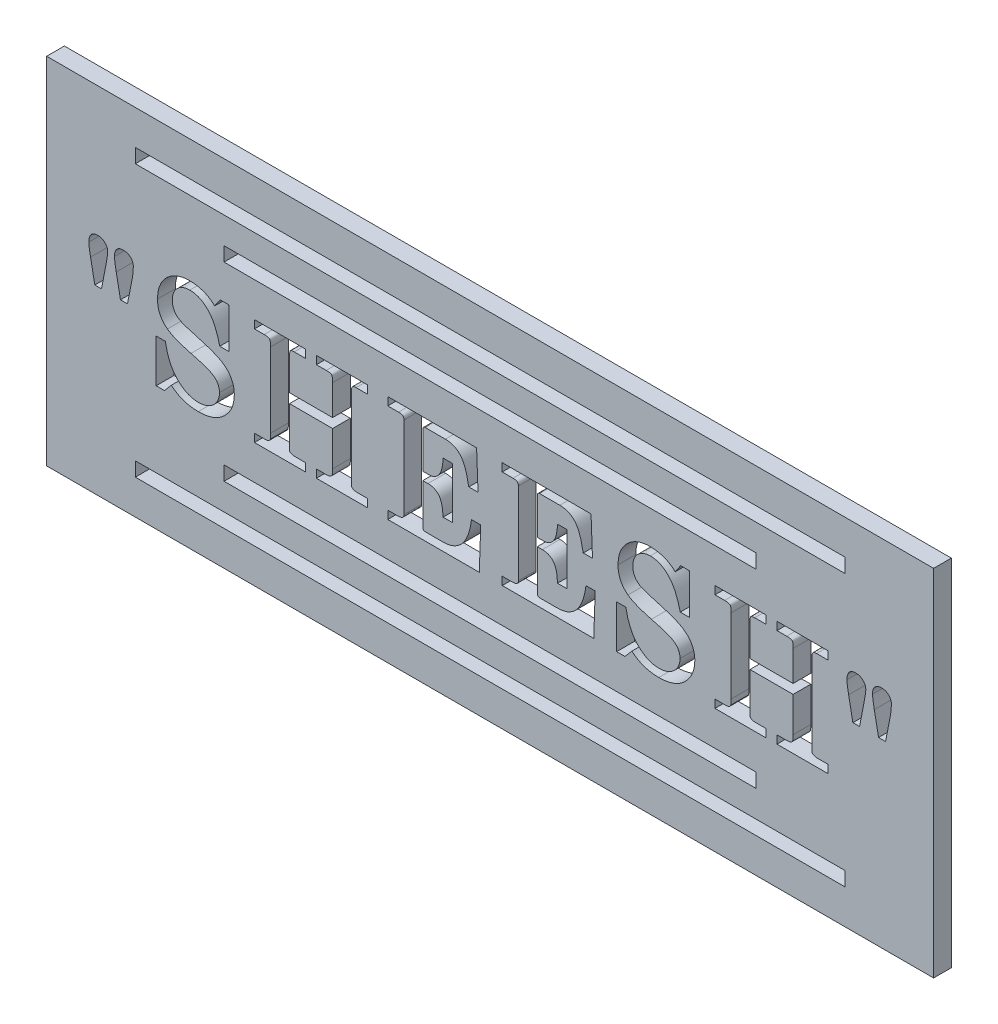
from build123d import *

# Parameters (mm, degrees)
SKETCH1_W           = 500
SKETCH1_H           = 200
SKETCH1_W_2         = 400
SKETCH1_H_2         = 8
SKETCH1_W_3         = 300
BOSS_EXTRUDE1_DEPTH = 10


with BuildPart() as part:
    # Sketch1 → Boss-Extrude1 (new body)
    with BuildSketch(Plane.XY):
        Rectangle(SKETCH1_W, SKETCH1_H)
        with Locations((0, 76.5)):
            Rectangle(SKETCH1_W_2, SKETCH1_H_2, mode=Mode.SUBTRACT)
        with Locations((0, 53.5)):
            Rectangle(SKETCH1_W_3, SKETCH1_H_2, mode=Mode.SUBTRACT)
        with Locations((0, -76.5)):
            Rectangle(SKETCH1_W_2, SKETCH1_H_2, mode=Mode.SUBTRACT)
        with Locations((0, -53.5)):
            Rectangle(SKETCH1_W_3, SKETCH1_H_2, mode=Mode.SUBTRACT)
        with BuildLine():
            Line((-222.856012658, 1.898734177), (-225.241297468, 14.299841772))
            add(Edge.make_bspline(
                [(-225.241297468, 14.299841772), (-225.318102546, 14.687192515), (-225.465996871, 15.433067381), (-225.65297757, 16.514319414), (-225.818124979, 17.507379698), (-225.964987305, 18.412015943), (-226.07429705, 19.231044839), (-226.140658225, 19.963851805), (-226.197168862, 20.608318296), (-226.200830159, 21.008600319), (-226.202531646, 21.194620253)],
                knots=[0, 0, 0, 0, 1.359655747, 2.618125993, 3.778022415, 4.825997999, 5.773767445, 6.622178217, 7.359695656, 8, 8, 8, 8], degree=3))
            add(Edge.make_bspline(
                [(-226.202531646, 21.194620253), (-226.189564923, 21.647118965), (-226.165219749, 22.496690602), (-225.909089843, 23.681974668), (-225.518731247, 24.700805307), (-224.934335383, 25.531881954), (-224.205336462, 26.165446657), (-223.373167847, 26.649835697), (-222.403772082, 26.906425424), (-221.726034938, 26.942969357), (-221.372626582, 26.962025316)],
                knots=[0, 0, 0, 0, 1.270862651, 2.38605953, 3.394385714, 4.320533972, 5.211316542, 6.093229129, 7.005707794, 8, 8, 8, 8], degree=3))
            add(Edge.make_bspline(
                [(-221.372626582, 26.962025316), (-220.955312842, 26.946264862), (-220.148702914, 26.915802075), (-219.007278145, 26.612469741), (-217.99462394, 26.120294146), (-217.142929701, 25.434904285), (-216.446141524, 24.63861562), (-215.931591286, 23.75441976), (-215.620035246, 22.797417755), (-215.586526684, 22.13437419), (-215.569620253, 21.799841772)],
                knots=[0, 0, 0, 0, 1.154916135, 2.232293665, 3.247594324, 4.254746992, 5.242118899, 6.165794001, 7.074568551, 8, 8, 8, 8], degree=3))
            add(Edge.make_bspline(
                [(-215.569620253, 21.799841772), (-215.57109047, 21.64541975), (-215.574491862, 21.288159751), (-215.647743939, 20.687999904), (-215.724898144, 19.951286845), (-215.844728595, 19.080135388), (-216.017881861, 18.077743391), (-216.202665681, 16.936960485), (-216.431474996, 15.663739365), (-216.5976004, 14.770474545), (-216.685126582, 14.299841772)],
                knots=[0, 0, 0, 0, 0.488047033, 1.129111508, 1.909654003, 2.831406391, 3.909075828, 5.12659328, 6.486093553, 8, 8, 8, 8], degree=3))
            Line((-216.685126582, 14.299841772), (-219.070411392, 1.898734177))
            Line((-219.070411392, 1.898734177), (-222.856012658, 1.898734177))
        make_face(mode=Mode.SUBTRACT)
        with BuildLine():
            Line((-208.378164557, 1.898734177), (-210.775316456, 14.299841772))
            add(Edge.make_bspline(
                [(-210.775316456, 14.299841772), (-210.855568655, 14.711014187), (-211.009698664, 15.500699804), (-211.213237115, 16.639837744), (-211.374227751, 17.681697875), (-211.52279548, 18.617807726), (-211.626512842, 19.45357005), (-211.713921043, 20.188530921), (-211.765415916, 20.825977412), (-211.77004887, 21.218282393), (-211.772151899, 21.396360759)],
                knots=[0, 0, 0, 0, 1.401467564, 2.69161728, 3.870781524, 4.928194173, 5.862141366, 6.687810886, 7.404360115, 8, 8, 8, 8], degree=3))
            add(Edge.make_bspline(
                [(-211.772151899, 21.396360759), (-211.760019956, 21.833245774), (-211.737154855, 22.656643968), (-211.469199194, 23.799539269), (-211.060004348, 24.784679229), (-210.449703787, 25.5808272), (-209.703993287, 26.210209562), (-208.833428866, 26.650382818), (-207.856522209, 26.923781074), (-207.169630541, 26.948923987), (-206.811708861, 26.962025316)],
                knots=[0, 0, 0, 0, 1.236768738, 2.330940888, 3.310742517, 4.239823643, 5.147795877, 6.056114706, 6.987091089, 8, 8, 8, 8], degree=3))
            add(Edge.make_bspline(
                [(-206.811708861, 26.962025316), (-206.390800833, 26.945295373), (-205.585753324, 26.913296934), (-204.446701675, 26.630224308), (-203.45694415, 26.129824266), (-202.628680026, 25.4493527), (-201.964511981, 24.648930759), (-201.492015513, 23.759070493), (-201.190038938, 22.80416443), (-201.156361185, 22.138330271), (-201.139240506, 21.799841772)],
                knots=[0, 0, 0, 0, 1.175948973, 2.249172575, 3.253477426, 4.252100082, 5.226596206, 6.142172504, 7.055540736, 8, 8, 8, 8], degree=3))
            add(Edge.make_bspline(
                [(-201.139240506, 21.799841772), (-201.153332472, 21.229951441), (-201.182442051, 20.052736841), (-201.340705602, 18.229809568), (-201.615540322, 16.297658911), (-201.872927057, 14.979159615), (-202.005537975, 14.299841772)],
                knots=[0, 0, 0, 0, 0.904493599, 1.868399958, 2.901755999, 4, 4, 4, 4], degree=3))
            Line((-202.005537975, 14.299841772), (-204.438291139, 1.898734177))
            Line((-204.438291139, 1.898734177), (-208.378164557, 1.898734177))
        make_face(mode=Mode.SUBTRACT)
        with BuildLine():
            Line((-155.309109403, 25.443037975), (-152.176198011, 30))
            Line((-152.176198011, 30), (-147.251356239, 30))
            Line((-147.251356239, 30), (-147.251356239, 7.215189873))
            Line((-147.251356239, 7.215189873), (-152.413539783, 7.215189873))
            add(Edge.make_bspline(
                [(-152.413539783, 7.215189873), (-152.620166884, 8.039829818), (-153.020845717, 9.638921947), (-153.718284657, 11.934745317), (-154.491335211, 14.042631575), (-155.300790942, 15.976929397), (-156.192740126, 17.712590259), (-157.14067561, 19.270152376), (-158.163567564, 20.635945387), (-159.233681792, 21.83448234), (-160.363255148, 22.861159709), (-161.523094016, 23.756242112), (-162.73030036, 24.505783206), (-163.969025282, 25.134024227), (-165.257794183, 25.604919824), (-166.579580419, 25.954307601), (-167.941182376, 26.159048472), (-168.860658242, 26.187958757), (-169.324141049, 26.202531646)],
                knots=[0, 0, 0, 0, 1.478441552, 2.866904838, 4.170608397, 5.382023723, 6.511257998, 7.561417234, 8.549360617, 9.47494599, 10.351468781, 11.200478944, 12.01943787, 12.819392841, 13.611738079, 14.401030875, 15.194003099, 16, 16, 16, 16], degree=3))
            add(Edge.make_bspline(
                [(-169.324141049, 26.202531646), (-169.664627315, 26.191684013), (-170.331815287, 26.170427915), (-171.31439117, 26.0541286), (-172.257848982, 25.841074408), (-173.155587876, 25.527018824), (-174.021231325, 25.152519814), (-174.830747302, 24.668308728), (-175.60471889, 24.108119011), (-176.337545951, 23.474368348), (-176.994791118, 22.767750796), (-177.573790632, 22.010464343), (-178.067165635, 21.201905605), (-178.446569041, 20.329583876), (-178.784913343, 19.424588375), (-178.985434014, 18.456246587), (-179.122307532, 17.444592038), (-179.1407108, 16.752868193), (-179.150090416, 16.400316456)],
                knots=[0, 0, 0, 0, 1.052011806, 2.061432996, 3.051512964, 4.033035075, 4.995818849, 5.959842525, 6.939994539, 7.944671068, 8.947562561, 9.915373557, 10.885649924, 11.864582464, 12.85012769, 13.86405047, 14.911367994, 16, 16, 16, 16], degree=3))
            add(Edge.make_bspline(
                [(-179.150090416, 16.400316456), (-179.136817863, 15.956403209), (-179.111308622, 15.103222172), (-178.904693793, 13.871087038), (-178.569658748, 12.740292663), (-178.071633464, 11.716715742), (-177.453269808, 10.79660665), (-176.701641094, 9.97748841), (-175.829079348, 9.249617457), (-174.988320947, 8.720013005), (-174.205670626, 8.332980981), (-173.488907651, 8.023697299), (-172.642443895, 7.70808152), (-171.677649401, 7.366228697), (-170.590291379, 7.007808963), (-169.379233575, 6.64089068), (-168.039577382, 6.266029536), (-167.105081932, 6.008379648), (-166.618444846, 5.874208861)],
                knots=[0, 0, 0, 0, 1.180352333, 2.268583414, 3.313885695, 4.307030757, 5.284835665, 6.253251243, 7.254393129, 8.299642433, 8.887939053, 9.576100266, 10.375491256, 11.290817276, 12.299178963, 13.421083908, 14.657033363, 16, 16, 16, 16], degree=3))
            add(Edge.make_bspline(
                [(-166.618444846, 5.874208861), (-165.850503688, 5.662528509), (-164.363339247, 5.25259672), (-162.221526066, 4.628454038), (-160.244752829, 4.006972584), (-158.425139641, 3.40785277), (-156.774178504, 2.801931268), (-155.277747766, 2.223631789), (-153.95179616, 1.644492364), (-152.424926751, 0.899236106), (-150.733803083, -0.072901938), (-148.969798538, -1.411501839), (-147.477528494, -2.888374412), (-146.275552276, -4.520190358), (-145.361091217, -6.283622484), (-144.682004093, -8.155446407), (-144.285470522, -10.15740574), (-144.237736797, -11.533064273), (-144.213381555, -12.234968354)],
                knots=[0, 0, 0, 0, 1.217609519, 2.357974383, 3.409782111, 4.384933562, 5.285857577, 6.09766231, 6.83684171, 7.496655379, 8.694421234, 9.811840936, 10.872164904, 11.892854872, 12.896241002, 13.898424008, 14.927710088, 16, 16, 16, 16], degree=3))
            add(Edge.make_bspline(
                [(-144.213381555, -12.234968354), (-144.227763938, -12.872783702), (-144.256029937, -14.126295535), (-144.526385766, -15.967315784), (-144.963010389, -17.734183895), (-145.587452723, -19.425466736), (-146.368946419, -21.049102802), (-147.341549262, -22.589184545), (-148.484732807, -24.049972087), (-149.787093776, -25.421885274), (-151.226954578, -26.67868838), (-152.797228595, -27.775990521), (-154.486662664, -28.688278946), (-156.272953158, -29.46060768), (-158.18377513, -30.030668944), (-160.197773627, -30.465375909), (-162.328231208, -30.713035105), (-163.785546965, -30.743787564), (-164.529837251, -30.759493671)],
                knots=[0, 0, 0, 0, 0.993765015, 1.953067152, 2.893816473, 3.826344344, 4.758545928, 5.69785916, 6.660030947, 7.645843102, 8.642473926, 9.6346688, 10.625367815, 11.631038732, 12.662931336, 13.728473925, 14.839870643, 16, 16, 16, 16], degree=3))
            add(Edge.make_bspline(
                [(-164.529837251, -30.759493671), (-165.282150143, -30.74433341), (-166.755458417, -30.714643983), (-168.914780528, -30.4583811), (-170.972494989, -30.047811535), (-172.928074543, -29.465997498), (-174.779702895, -28.71388687), (-176.529151903, -27.797838193), (-178.183092944, -26.716301281), (-179.18985972, -25.868992712), (-179.695976492, -25.443037975)],
                knots=[0, 0, 0, 0, 1.097676947, 2.149659464, 3.168680871, 4.15686523, 5.122824642, 6.080884398, 7.035231777, 8, 8, 8, 8], degree=3))
            Line((-179.695976492, -25.443037975), (-183.588381555, -30))
            Line((-183.588381555, -30), (-188.264014467, -30))
            Line((-188.264014467, -30), (-188.264014467, -5.696202532))
            Line((-188.264014467, -5.696202532), (-183.078096745, -5.696202532))
            add(Edge.make_bspline(
                [(-183.078096745, -5.696202532), (-182.925261273, -6.520933367), (-182.627299882, -8.128792742), (-182.036104575, -10.446030174), (-181.321981214, -12.601505921), (-180.505386306, -14.602270347), (-179.579268795, -16.448771793), (-178.546551253, -18.1452632), (-177.396096699, -19.681622986), (-176.132185875, -21.045156603), (-174.808723399, -22.249608223), (-173.448426377, -23.302813468), (-172.059112741, -24.201537659), (-170.62809038, -24.924601553), (-169.176668045, -25.502721112), (-167.692567962, -25.90898861), (-166.179483251, -26.151726587), (-165.159656966, -26.185569289), (-164.648508137, -26.202531646)],
                knots=[0, 0, 0, 0, 1.340731878, 2.613832573, 3.819754391, 4.96832973, 6.065690446, 7.118863331, 8.139579765, 9.128675541, 10.086693529, 10.997457033, 11.876352768, 12.727671762, 13.556785127, 14.369922536, 15.182986163, 16, 16, 16, 16], degree=3))
            add(Edge.make_bspline(
                [(-164.648508137, -26.202531646), (-164.209053388, -26.193692113), (-163.351463636, -26.176441888), (-162.095857087, -26.033666169), (-160.90819042, -25.785780432), (-159.787063684, -25.436088558), (-158.720394369, -25.013092485), (-157.717525028, -24.475082651), (-156.78438185, -23.831846324), (-155.91214261, -23.11042005), (-155.141855003, -22.303806879), (-154.44498562, -21.468115313), (-153.872125157, -20.575515687), (-153.391867557, -19.648476942), (-153.023394917, -18.672034833), (-152.767118651, -17.656317463), (-152.58702901, -16.60446853), (-152.574287483, -15.886858481), (-152.567811935, -15.522151899)],
                knots=[0, 0, 0, 0, 1.170415552, 2.284049462, 3.360778311, 4.397365105, 5.409014661, 6.413172861, 7.421524268, 8.423967045, 9.422525446, 10.388585579, 11.318033585, 12.241729407, 13.165485333, 14.090682564, 15.029639237, 16, 16, 16, 16], degree=3))
            add(Edge.make_bspline(
                [(-152.567811935, -15.522151899), (-152.580081034, -15.121572509), (-152.604098205, -14.337424983), (-152.833582424, -13.200398145), (-153.219893025, -12.143649439), (-153.746051338, -11.154207681), (-154.449674949, -10.2306602), (-155.358483578, -9.395237364), (-156.42921033, -8.591374942), (-157.486494404, -7.999735369), (-158.476012961, -7.513284606), (-159.420210724, -7.141345764), (-160.535875524, -6.745149326), (-161.817723309, -6.292667279), (-163.291303444, -5.87245779), (-164.92599048, -5.391836488), (-166.735861667, -4.889270252), (-168.006152005, -4.569936865), (-168.671451175, -4.402689873)],
                knots=[0, 0, 0, 0, 0.902972765, 1.767599329, 2.603276562, 3.433791112, 4.28701184, 5.208710783, 6.210056205, 7.301523046, 7.936173765, 8.696860966, 9.588962965, 10.607813546, 11.762677631, 13.044964588, 14.452336014, 16, 16, 16, 16], degree=3))
            add(Edge.make_bspline(
                [(-168.671451175, -4.402689873), (-169.424127397, -4.204946485), (-170.875290486, -3.823696357), (-172.958506397, -3.207222107), (-174.866147024, -2.569099543), (-176.603551904, -1.915345585), (-178.176886798, -1.257313807), (-179.57621412, -0.566216995), (-180.818640574, 0.1206497), (-181.554950096, 0.634901957), (-181.903254973, 0.878164557)],
                knots=[0, 0, 0, 0, 1.304010873, 2.514138736, 3.639767437, 4.673931226, 5.624386477, 6.495936856, 7.288515886, 8, 8, 8, 8], degree=3))
            add(Edge.make_bspline(
                [(-181.903254973, 0.878164557), (-182.352956281, 1.234420519), (-183.235520284, 1.933592799), (-184.364363841, 3.171807352), (-185.35276153, 4.483873578), (-186.137207799, 5.931473111), (-186.761750899, 7.474180915), (-187.177328046, 9.136725231), (-187.467590624, 10.895683814), (-187.492014996, 12.111078217), (-187.504520796, 12.733386076)],
                knots=[0, 0, 0, 0, 1.008498416, 1.979234626, 2.940330015, 3.894105417, 4.869203611, 5.862437387, 6.905522347, 8, 8, 8, 8], degree=3))
            add(Edge.make_bspline(
                [(-187.504520796, 12.733386076), (-187.488146688, 13.378864987), (-187.456087482, 14.642661533), (-187.217282552, 16.491534679), (-186.811148065, 18.252108924), (-186.245825996, 19.923843983), (-185.509269784, 21.506016606), (-184.634439121, 23.008308754), (-183.582122362, 24.416303959), (-182.372054394, 25.711259567), (-181.050322161, 26.897765553), (-179.623882948, 27.93416792), (-178.105745742, 28.803996373), (-176.504397354, 29.521231788), (-174.815247231, 30.081368013), (-173.032898198, 30.468499934), (-171.166282853, 30.711517651), (-169.890564486, 30.743308388), (-169.241071429, 30.759493671)],
                knots=[0, 0, 0, 0, 1.076771103, 2.108232473, 3.104026481, 4.087053372, 5.04676228, 6.011157306, 6.982662429, 7.972731608, 8.963680301, 9.94190996, 10.908695847, 11.877686904, 12.864870188, 13.872081108, 14.916635063, 16, 16, 16, 16], degree=3))
            add(Edge.make_bspline(
                [(-169.241071429, 30.759493671), (-168.571857032, 30.743431813), (-167.244561363, 30.711575304), (-165.280736651, 30.459837727), (-163.377475086, 30.0263454), (-161.535688284, 29.449252639), (-159.782370957, 28.712714098), (-158.15545449, 27.785455855), (-156.647286408, 26.710837224), (-155.754810412, 25.865298559), (-155.309109403, 25.443037975)],
                knots=[0, 0, 0, 0, 1.049245881, 2.081036395, 3.098367193, 4.106770031, 5.104565985, 6.074038789, 7.038178217, 8, 8, 8, 8], degree=3))
        make_face(mode=Mode.SUBTRACT)
        with BuildLine():
            Line((-132.857142857, 30), (-103.996383363, 30))
            Line((-103.996383363, 30), (-103.996383363, 25.443037975))
            Line((-103.996383363, 25.443037975), (-110.452079566, 25.443037975))
            add(Edge.make_bspline(
                [(-110.452079566, 25.443037975), (-110.712930804, 25.434324792), (-111.184854657, 25.418561176), (-111.827089681, 25.355259254), (-112.303705462, 25.191900514), (-112.702744895, 24.954667435), (-112.898462352, 24.430867657), (-113.015228577, 23.67483702), (-113.109659786, 22.580120636), (-113.110073567, 21.740392275), (-113.110307414, 21.265822785)],
                knots=[0, 0, 0, 0, 1.038527511, 1.878871299, 2.54503206, 3.042111593, 3.65374165, 4.661845414, 6.113453831, 8, 8, 8, 8], degree=3))
            Line((-113.110307414, 21.265822785), (-113.110307414, 4.17721519))
            Line((-113.110307414, 4.17721519), (-88.806509946, 4.17721519))
            Line((-88.806509946, 4.17721519), (-88.806509946, 21.265822785))
            add(Edge.make_bspline(
                [(-88.806509946, 21.265822785), (-88.81411831, 21.72036302), (-88.827702491, 22.531911515), (-88.898881287, 23.600073172), (-89.066127057, 24.353018912), (-89.304351967, 24.901517653), (-89.805396278, 25.175546236), (-90.465519995, 25.327927745), (-91.367264891, 25.429724101), (-92.04602648, 25.438259933), (-92.425971971, 25.443037975)],
                knots=[0, 0, 0, 0, 1.589621298, 2.838153091, 3.719591463, 4.300773288, 4.841270955, 5.629023451, 6.672815518, 8, 8, 8, 8], degree=3))
            Line((-92.425971971, 25.443037975), (-97.920433996, 25.443037975))
            Line((-97.920433996, 25.443037975), (-97.920433996, 30))
            Line((-97.920433996, 30), (-69.059674503, 30))
            Line((-69.059674503, 30), (-69.059674503, 25.443037975))
            Line((-69.059674503, 25.443037975), (-75.574706148, 25.443037975))
            add(Edge.make_bspline(
                [(-75.574706148, 25.443037975), (-75.772318052, 25.440610577), (-76.124491687, 25.436284594), (-76.599769388, 25.410913103), (-76.949364995, 25.335583093), (-77.230235471, 25.262656314), (-77.42931863, 25.066761621), (-77.631664506, 24.802521223), (-77.835299941, 24.42102394), (-77.969623533, 24.130405271), (-78.043060579, 23.971518987)],
                knots=[0, 0, 0, 0, 1.484198858, 2.645061841, 3.553035337, 4.181901776, 4.770994092, 5.596129064, 6.685761928, 8, 8, 8, 8], degree=3))
            add(Edge.make_bspline(
                [(-78.043060579, 23.971518987), (-78.065212701, 23.865007087), (-78.13180108, 23.544836649), (-78.136250213, 22.894696977), (-78.169750082, 21.93100695), (-78.172199209, 21.182950708), (-78.173598553, 20.755537975)],
                knots=[0, 0, 0, 0, 0.404448898, 1.215756922, 2.409182519, 4, 4, 4, 4], degree=3))
            Line((-78.173598553, 20.755537975), (-78.173598553, -21.194620253))
            add(Edge.make_bspline(
                [(-78.173598553, -21.194620253), (-78.174858981, -21.634300597), (-78.177051121, -22.398993959), (-78.119714992, -23.363370577), (-78.125002844, -23.998361821), (-78.026631122, -24.284664029), (-77.995592224, -24.375)],
                knots=[0, 0, 0, 0, 1.649063729, 2.86805654, 3.642841692, 4, 4, 4, 4], degree=3))
            add(Edge.make_bspline(
                [(-77.995592224, -24.375), (-77.825201492, -24.539817319), (-77.473095786, -24.880405787), (-76.763747097, -25.204576064), (-75.930451845, -25.40753872), (-75.326960344, -25.4306901), (-75.005085895, -25.443037975)],
                knots=[0, 0, 0, 0, 0.865089173, 1.787672543, 2.82004688, 4, 4, 4, 4], degree=3))
            Line((-75.005085895, -25.443037975), (-69.059674503, -25.443037975))
            Line((-69.059674503, -25.443037975), (-69.059674503, -30))
            Line((-69.059674503, -30), (-97.920433996, -30))
            Line((-97.920433996, -30), (-97.920433996, -25.443037975))
            Line((-97.920433996, -25.443037975), (-92.425971971, -25.443037975))
            add(Edge.make_bspline(
                [(-92.425971971, -25.443037975), (-92.056486952, -25.431468495), (-91.378237458, -25.410230846), (-90.463487061, -25.210968152), (-89.716790677, -24.89977449), (-89.386879233, -24.541377761), (-89.233725136, -24.375)],
                knots=[0, 0, 0, 0, 1.272417678, 2.33572838, 3.227398679, 4, 4, 4, 4], degree=3))
            add(Edge.make_bspline(
                [(-89.233725136, -24.375), (-89.163616727, -24.230783203), (-88.983995482, -23.861292569), (-88.900276953, -23.101647604), (-88.808115136, -22.068034657), (-88.80708896, -21.27449281), (-88.806509946, -20.826740506)],
                knots=[0, 0, 0, 0, 0.531148335, 1.360828557, 2.510859765, 4, 4, 4, 4], degree=3))
            Line((-88.806509946, -20.826740506), (-88.806509946, -1.139240506))
            Line((-88.806509946, -1.139240506), (-113.110307414, -1.139240506))
            Line((-113.110307414, -1.139240506), (-113.110307414, -21.147151899))
            add(Edge.make_bspline(
                [(-113.110307414, -21.147151899), (-113.108992771, -21.598492779), (-113.106709206, -22.382482079), (-113.073358317, -23.376329011), (-113.068735606, -24.023311335), (-112.982379298, -24.320071109), (-112.956035262, -24.410601266)],
                knots=[0, 0, 0, 0, 1.652561605, 2.870536816, 3.655443599, 4, 4, 4, 4], degree=3))
            add(Edge.make_bspline(
                [(-112.956035262, -24.410601266), (-112.805200804, -24.570186572), (-112.503804668, -24.889068579), (-111.903453145, -25.209071454), (-111.214197856, -25.42152211), (-110.71500105, -25.435615265), (-110.452079566, -25.443037975)],
                knots=[0, 0, 0, 0, 0.935461931, 1.869232109, 2.877747915, 4, 4, 4, 4], degree=3))
            Line((-110.452079566, -25.443037975), (-103.996383363, -25.443037975))
            Line((-103.996383363, -25.443037975), (-103.996383363, -30))
            Line((-103.996383363, -30), (-132.857142857, -30))
            Line((-132.857142857, -30), (-132.857142857, -25.443037975))
            Line((-132.857142857, -25.443037975), (-126.721858047, -25.443037975))
            add(Edge.make_bspline(
                [(-126.721858047, -25.443037975), (-126.527750478, -25.439269829), (-126.165715657, -25.432241767), (-125.659887663, -25.361441009), (-125.226361161, -25.246565847), (-124.750282352, -25.026627664), (-124.263279534, -24.62105915), (-124.042445468, -24.186637259), (-123.933092224, -23.971518987)],
                knots=[0, 0, 0, 0, 1.035371359, 1.931096697, 2.719922878, 3.418869296, 4.721868329, 6, 6, 6, 6], degree=3))
            add(Edge.make_bspline(
                [(-123.933092224, -23.971518987), (-123.902494168, -23.841441928), (-123.82180362, -23.498413958), (-123.784672978, -22.844269168), (-123.746343636, -21.942912258), (-123.744341201, -21.25807205), (-123.743218807, -20.874208861)],
                knots=[0, 0, 0, 0, 0.514976872, 1.35805246, 2.519148853, 4, 4, 4, 4], degree=3))
            Line((-123.743218807, -20.874208861), (-123.743218807, 21.230221519))
            add(Edge.make_bspline(
                [(-123.743218807, 21.230221519), (-123.746499822, 21.677585628), (-123.752351503, 22.475458184), (-123.86843935, 23.525898799), (-124.027479263, 24.293390271), (-124.318884663, 24.840556393), (-124.822516549, 25.134533235), (-125.481924007, 25.323457966), (-126.362791327, 25.42999377), (-127.022295206, 25.438397936), (-127.386415009, 25.443037975)],
                knots=[0, 0, 0, 0, 1.569344473, 2.798921196, 3.701323504, 4.317990042, 4.899425663, 5.685386411, 6.722074772, 8, 8, 8, 8], degree=3))
            Line((-127.386415009, 25.443037975), (-132.857142857, 25.443037975))
            Line((-132.857142857, 25.443037975), (-132.857142857, 30))
        make_face(mode=Mode.SUBTRACT)
        with BuildLine():
            Line((-57.703435805, 30), (-7.624321881, 30))
            Line((-7.624321881, 30), (-6.817359855, 8.734177215))
            Line((-6.817359855, 8.734177215), (-12.027011754, 8.734177215))
            add(Edge.make_bspline(
                [(-12.027011754, 8.734177215), (-12.168939879, 9.510309514), (-12.442072358, 11.003931287), (-12.906470963, 13.142476859), (-13.447949123, 15.08383724), (-14.010920715, 16.839917266), (-14.66509851, 18.389975695), (-15.325245507, 19.764702562), (-16.06477477, 20.936903309), (-16.855672245, 21.926743283), (-17.709074139, 22.759917983), (-18.600657037, 23.486289207), (-19.570748247, 24.084368954), (-20.585223112, 24.586548754), (-21.67156941, 24.963530138), (-22.80468805, 25.256240274), (-24.008933649, 25.403785356), (-24.827321959, 25.429733256), (-25.246948463, 25.443037975)],
                knots=[0, 0, 0, 0, 1.606601027, 3.091810865, 4.453838175, 5.709567891, 6.843419852, 7.877246899, 8.811312136, 9.659160603, 10.450858333, 11.235807582, 11.995684692, 12.766581231, 13.535961416, 14.333008655, 15.14525447, 16, 16, 16, 16], degree=3))
            Line((-25.246948463, 25.443037975), (-36.674954792, 25.443037975))
            add(Edge.make_bspline(
                [(-36.674954792, 25.443037975), (-36.837666492, 25.425308047), (-37.174291647, 25.38862759), (-37.539567631, 25.106719825), (-37.762457884, 24.751000258), (-37.881713883, 24.343202584), (-37.945985871, 23.811527583), (-37.952818751, 23.417969973), (-37.956600362, 23.200158228)],
                knots=[0, 0, 0, 0, 0.996355833, 2.061304968, 2.698235786, 3.571073002, 4.655727101, 6, 6, 6, 6], degree=3))
            Line((-37.956600362, 23.200158228), (-37.956600362, 3.417721519))
            Line((-37.956600362, 3.417721519), (-34.669416817, 3.417721519))
            add(Edge.make_bspline(
                [(-34.669416817, 3.417721519), (-34.384285149, 3.428750941), (-33.823472634, 3.45044421), (-33.00147939, 3.564536958), (-32.219486727, 3.780270559), (-31.487289088, 4.093279681), (-30.784889007, 4.473752434), (-30.133169741, 4.955536502), (-29.514014302, 5.513185328), (-28.936193159, 6.162391451), (-28.411335667, 6.916914925), (-27.943366321, 7.790784269), (-27.565270297, 8.797092381), (-27.21024311, 9.909819773), (-26.965192768, 11.157769524), (-26.744977683, 12.51793291), (-26.60859575, 14.004857944), (-26.563723717, 15.035377473), (-26.540461121, 15.569620253)],
                knots=[0, 0, 0, 0, 0.833178728, 1.63874136, 2.418023045, 3.194816789, 3.960183926, 4.745948365, 5.555808242, 6.390587699, 7.27845171, 8.234724476, 9.277478911, 10.414076871, 11.642295621, 12.987196021, 14.438099688, 16, 16, 16, 16], degree=3))
            Line((-26.540461121, 15.569620253), (-21.247739602, 15.569620253))
            Line((-21.247739602, 15.569620253), (-21.247739602, -13.291139241))
            Line((-21.247739602, -13.291139241), (-26.540461121, -13.291139241))
            add(Edge.make_bspline(
                [(-26.540461121, -13.291139241), (-26.563640665, -12.733156425), (-26.608255875, -11.659169764), (-26.74461913, -10.11707171), (-26.961689212, -8.711679531), (-27.221643429, -7.442444332), (-27.57290753, -6.313569393), (-27.968973487, -5.317031124), (-28.426353816, -4.447184459), (-28.974005954, -3.728743857), (-29.562854406, -3.110369395), (-30.210742721, -2.589132955), (-30.899268759, -2.134328409), (-31.637951275, -1.76117535), (-32.431428666, -1.492505704), (-33.269213441, -1.290805924), (-34.158531613, -1.152264293), (-34.771724803, -1.14364217), (-35.084764919, -1.139240506)],
                knots=[0, 0, 0, 0, 1.588187051, 3.056889315, 4.399731435, 5.630964176, 6.737634775, 7.757100131, 8.678286266, 9.522027482, 10.317673412, 11.101298619, 11.881362611, 12.6611832, 13.447468734, 14.257850829, 15.110618666, 16, 16, 16, 16], degree=3))
            Line((-35.084764919, -1.139240506), (-37.956600362, -1.139240506))
            Line((-37.956600362, -1.139240506), (-37.956600362, -23.591772152))
            add(Edge.make_bspline(
                [(-37.956600362, -23.591772152), (-37.956271909, -23.766865805), (-37.95566845, -24.088561153), (-37.849503392, -24.515357261), (-37.73797555, -24.869269662), (-37.512921573, -25.115595696), (-37.212489984, -25.276695549), (-36.826892291, -25.37503034), (-36.348189823, -25.429008163), (-35.998694418, -25.438096317), (-35.808657324, -25.443037975)],
                knots=[0, 0, 0, 0, 1.238465799, 2.275403362, 3.121280802, 3.838149853, 4.581016507, 5.515699395, 6.649168887, 8, 8, 8, 8], degree=3))
            Line((-35.808657324, -25.443037975), (-26.789669982, -25.443037975))
            add(Edge.make_bspline(
                [(-26.789669982, -25.443037975), (-26.219202749, -25.431256292), (-25.105200098, -25.40824914), (-23.484132048, -25.173751701), (-21.950656543, -24.810645283), (-20.513689265, -24.287902678), (-19.165887773, -23.617582636), (-17.91740907, -22.789501043), (-16.743474256, -21.830703929), (-15.688208352, -20.697249917), (-14.706560581, -19.435376308), (-13.831605301, -18.015472294), (-13.048588486, -16.448489974), (-12.346690872, -14.741281071), (-11.759333637, -12.876270856), (-11.254617689, -10.870458935), (-10.816898955, -8.718137005), (-10.628673124, -7.224662733), (-10.53175859, -6.455696203)],
                knots=[0, 0, 0, 0, 0.983612113, 1.920787797, 2.819606009, 3.698300048, 4.552889918, 5.410363523, 6.278069454, 7.161521226, 8.076135295, 9.032497229, 10.033592872, 11.095642674, 12.213647306, 13.403773247, 14.663243475, 16, 16, 16, 16], degree=3))
            Line((-10.53175859, -6.455696203), (-5.298372514, -6.455696203))
            Line((-5.298372514, -6.455696203), (-6.105334539, -30))
            Line((-6.105334539, -30), (-57.703435805, -30))
            Line((-57.703435805, -30), (-57.703435805, -25.443037975))
            Line((-57.703435805, -25.443037975), (-52.517518083, -25.443037975))
            add(Edge.make_bspline(
                [(-52.517518083, -25.443037975), (-52.161191042, -25.438376064), (-51.505463255, -25.429797022), (-50.619804576, -25.318800498), (-49.921195665, -25.134756793), (-49.386895123, -24.878103606), (-49.025276592, -24.505177684), (-48.773454014, -24.081746978), (-48.607912937, -23.587638681), (-48.595875292, -23.233236162), (-48.589511754, -23.045886076)],
                knots=[0, 0, 0, 0, 1.624761521, 2.989953476, 4.058147112, 4.91361582, 5.653594097, 6.390044448, 7.148918829, 8, 8, 8, 8], degree=3))
            Line((-48.589511754, -23.045886076), (-48.589511754, 23.164556962))
            add(Edge.make_bspline(
                [(-48.589511754, 23.164556962), (-48.599987488, 23.347004792), (-48.619817608, 23.692370808), (-48.730376412, 24.178799211), (-48.94947753, 24.584129344), (-49.266148916, 24.909446058), (-49.682712814, 25.166390688), (-50.230348198, 25.321605857), (-50.891473568, 25.42759428), (-51.37771857, 25.437635222), (-51.639353526, 25.443037975)],
                knots=[0, 0, 0, 0, 0.998383602, 1.889897874, 2.702681452, 3.482587858, 4.346672522, 5.345056125, 6.571448297, 8, 8, 8, 8], degree=3))
            Line((-51.639353526, 25.443037975), (-57.703435805, 25.443037975))
            Line((-57.703435805, 25.443037975), (-57.703435805, 30))
        make_face(mode=Mode.SUBTRACT)
        with BuildLine():
            Line((6.817359855, 30), (56.896473779, 30))
            Line((56.896473779, 30), (57.703435805, 8.734177215))
            Line((57.703435805, 8.734177215), (52.493783906, 8.734177215))
            add(Edge.make_bspline(
                [(52.493783906, 8.734177215), (52.351855781, 9.510309514), (52.078723302, 11.003931287), (51.614324697, 13.142476859), (51.072846537, 15.08383724), (50.509874945, 16.839917266), (49.85569715, 18.389975695), (49.195550153, 19.764702562), (48.45602089, 20.936903309), (47.665123415, 21.926743283), (46.811721521, 22.759917983), (45.920138623, 23.486289207), (44.950047413, 24.084368954), (43.935572548, 24.586548754), (42.84922625, 24.963530138), (41.71610761, 25.256240274), (40.511862011, 25.403785356), (39.693473701, 25.429733256), (39.273847197, 25.443037975)],
                knots=[0, 0, 0, 0, 1.606601027, 3.091810865, 4.453838175, 5.709567891, 6.843419852, 7.877246899, 8.811312136, 9.659160603, 10.450858333, 11.235807582, 11.995684692, 12.766581231, 13.535961416, 14.333008655, 15.14525447, 16, 16, 16, 16], degree=3))
            Line((39.273847197, 25.443037975), (27.845840868, 25.443037975))
            add(Edge.make_bspline(
                [(27.845840868, 25.443037975), (27.683129168, 25.425308047), (27.346504013, 25.38862759), (26.981228029, 25.106719825), (26.758337776, 24.751000258), (26.639081777, 24.343202584), (26.574809789, 23.811527583), (26.567976909, 23.417969973), (26.564195298, 23.200158228)],
                knots=[0, 0, 0, 0, 0.996355833, 2.061304968, 2.698235786, 3.571073002, 4.655727101, 6, 6, 6, 6], degree=3))
            Line((26.564195298, 23.200158228), (26.564195298, 3.417721519))
            Line((26.564195298, 3.417721519), (29.851378843, 3.417721519))
            add(Edge.make_bspline(
                [(29.851378843, 3.417721519), (30.136510511, 3.428750941), (30.697323026, 3.45044421), (31.51931627, 3.564536958), (32.301308933, 3.780270559), (33.033506572, 4.093279681), (33.735906653, 4.473752434), (34.387625919, 4.955536502), (35.006781358, 5.513185328), (35.584602501, 6.162391451), (36.109459993, 6.916914925), (36.577429339, 7.790784269), (36.955525363, 8.797092381), (37.31055255, 9.909819773), (37.555602892, 11.157769524), (37.775817977, 12.51793291), (37.91219991, 14.004857944), (37.957071943, 15.035377473), (37.980334539, 15.569620253)],
                knots=[0, 0, 0, 0, 0.833178728, 1.63874136, 2.418023045, 3.194816789, 3.960183926, 4.745948365, 5.555808242, 6.390587699, 7.27845171, 8.234724476, 9.277478911, 10.414076871, 11.642295621, 12.987196021, 14.438099688, 16, 16, 16, 16], degree=3))
            Line((37.980334539, 15.569620253), (43.273056058, 15.569620253))
            Line((43.273056058, 15.569620253), (43.273056058, -13.291139241))
            Line((43.273056058, -13.291139241), (37.980334539, -13.291139241))
            add(Edge.make_bspline(
                [(37.980334539, -13.291139241), (37.957154995, -12.733156425), (37.912539785, -11.659169764), (37.77617653, -10.11707171), (37.559106448, -8.711679531), (37.299152231, -7.442444332), (36.94788813, -6.313569393), (36.551822173, -5.317031124), (36.094441844, -4.447184459), (35.546789706, -3.728743857), (34.957941254, -3.110369395), (34.310052939, -2.589132955), (33.621526901, -2.134328409), (32.882844385, -1.76117535), (32.089366994, -1.492505704), (31.251582219, -1.290805924), (30.362264047, -1.152264293), (29.749070857, -1.14364217), (29.436030741, -1.139240506)],
                knots=[0, 0, 0, 0, 1.588187051, 3.056889315, 4.399731435, 5.630964176, 6.737634775, 7.757100131, 8.678286266, 9.522027482, 10.317673412, 11.101298619, 11.881362611, 12.6611832, 13.447468734, 14.257850829, 15.110618666, 16, 16, 16, 16], degree=3))
            Line((29.436030741, -1.139240506), (26.564195298, -1.139240506))
            Line((26.564195298, -1.139240506), (26.564195298, -23.591772152))
            add(Edge.make_bspline(
                [(26.564195298, -23.591772152), (26.564523752, -23.766865805), (26.565127211, -24.088561153), (26.671292268, -24.515357261), (26.78282011, -24.869269662), (27.007874087, -25.115595696), (27.308305676, -25.276695549), (27.693903369, -25.37503034), (28.172605837, -25.429008163), (28.522101242, -25.438096317), (28.712138336, -25.443037975)],
                knots=[0, 0, 0, 0, 1.238465799, 2.275403362, 3.121280802, 3.838149853, 4.581016507, 5.515699395, 6.649168887, 8, 8, 8, 8], degree=3))
            Line((28.712138336, -25.443037975), (37.731125678, -25.443037975))
            add(Edge.make_bspline(
                [(37.731125678, -25.443037975), (38.301592912, -25.431256292), (39.415595562, -25.40824914), (41.036663612, -25.173751701), (42.570139117, -24.810645283), (44.007106395, -24.287902678), (45.354907887, -23.617582636), (46.60338659, -22.789501043), (47.777321404, -21.830703929), (48.832587308, -20.697249917), (49.814235079, -19.435376308), (50.689190359, -18.015472294), (51.472207174, -16.448489974), (52.174104788, -14.741281071), (52.761462023, -12.876270856), (53.266177971, -10.870458935), (53.703896705, -8.718137005), (53.892122536, -7.224662733), (53.989037071, -6.455696203)],
                knots=[0, 0, 0, 0, 0.983612113, 1.920787797, 2.819606009, 3.698300048, 4.552889918, 5.410363523, 6.278069454, 7.161521226, 8.076135295, 9.032497229, 10.033592872, 11.095642674, 12.213647306, 13.403773247, 14.663243475, 16, 16, 16, 16], degree=3))
            Line((53.989037071, -6.455696203), (59.222423146, -6.455696203))
            Line((59.222423146, -6.455696203), (58.415461121, -30))
            Line((58.415461121, -30), (6.817359855, -30))
            Line((6.817359855, -30), (6.817359855, -25.443037975))
            Line((6.817359855, -25.443037975), (12.003277577, -25.443037975))
            add(Edge.make_bspline(
                [(12.003277577, -25.443037975), (12.359604618, -25.438376064), (13.015332405, -25.429797022), (13.900991084, -25.318800498), (14.599599995, -25.134756793), (15.133900537, -24.878103606), (15.495519068, -24.505177684), (15.747341646, -24.081746978), (15.912882723, -23.587638681), (15.924920368, -23.233236162), (15.931283906, -23.045886076)],
                knots=[0, 0, 0, 0, 1.624761521, 2.989953476, 4.058147112, 4.91361582, 5.653594097, 6.390044448, 7.148918829, 8, 8, 8, 8], degree=3))
            Line((15.931283906, -23.045886076), (15.931283906, 23.164556962))
            add(Edge.make_bspline(
                [(15.931283906, 23.164556962), (15.920808172, 23.347004792), (15.900978052, 23.692370808), (15.790419248, 24.178799211), (15.57131813, 24.584129344), (15.254646745, 24.909446058), (14.838082846, 25.166390688), (14.290447462, 25.321605857), (13.629322092, 25.42759428), (13.14307709, 25.437635222), (12.881442134, 25.443037975)],
                knots=[0, 0, 0, 0, 0.998383602, 1.889897874, 2.702681452, 3.482587858, 4.346672522, 5.345056125, 6.571448297, 8, 8, 8, 8], degree=3))
            Line((12.881442134, 25.443037975), (6.817359855, 25.443037975))
            Line((6.817359855, 25.443037975), (6.817359855, 30))
        make_face(mode=Mode.SUBTRACT)
        with BuildLine():
            Line((104.293060579, 25.443037975), (107.425971971, 30))
            Line((107.425971971, 30), (112.350813743, 30))
            Line((112.350813743, 30), (112.350813743, 7.215189873))
            Line((112.350813743, 7.215189873), (107.188630199, 7.215189873))
            add(Edge.make_bspline(
                [(107.188630199, 7.215189873), (106.982003098, 8.039829818), (106.581324265, 9.638921947), (105.883885325, 11.934745317), (105.110834771, 14.042631575), (104.30137904, 15.976929397), (103.409429856, 17.712590259), (102.461494372, 19.270152376), (101.438602417, 20.635945387), (100.36848819, 21.83448234), (99.238914833, 22.861159709), (98.079075966, 23.756242112), (96.871869622, 24.505783206), (95.6331447, 25.134024227), (94.344375799, 25.604919824), (93.022589563, 25.954307601), (91.660987606, 26.159048472), (90.74151174, 26.187958757), (90.278028933, 26.202531646)],
                knots=[0, 0, 0, 0, 1.478441552, 2.866904838, 4.170608397, 5.382023723, 6.511257998, 7.561417234, 8.549360617, 9.47494599, 10.351468781, 11.200478944, 12.01943787, 12.819392841, 13.611738079, 14.401030875, 15.194003099, 16, 16, 16, 16], degree=3))
            add(Edge.make_bspline(
                [(90.278028933, 26.202531646), (89.937542667, 26.191684013), (89.270354695, 26.170427915), (88.287778812, 26.0541286), (87.344321, 25.841074408), (86.446582106, 25.527018824), (85.580938656, 25.152519814), (84.77142268, 24.668308728), (83.997451092, 24.108119011), (83.264624031, 23.474368348), (82.607378864, 22.767750796), (82.02837935, 22.010464343), (81.535004347, 21.201905605), (81.155600941, 20.329583876), (80.817256639, 19.424588375), (80.616735968, 18.456246587), (80.47986245, 17.444592038), (80.461459182, 16.752868193), (80.452079566, 16.400316456)],
                knots=[0, 0, 0, 0, 1.052011806, 2.061432996, 3.051512964, 4.033035075, 4.995818849, 5.959842525, 6.939994539, 7.944671068, 8.947562561, 9.915373557, 10.885649924, 11.864582464, 12.85012769, 13.86405047, 14.911367994, 16, 16, 16, 16], degree=3))
            add(Edge.make_bspline(
                [(80.452079566, 16.400316456), (80.465352119, 15.956403209), (80.49086136, 15.103222172), (80.697476188, 13.871087038), (81.032511234, 12.740292663), (81.530536518, 11.716715742), (82.148900174, 10.79660665), (82.900528888, 9.97748841), (83.773090634, 9.249617457), (84.613849035, 8.720013005), (85.396499356, 8.332980981), (86.11326233, 8.023697299), (86.959726087, 7.70808152), (87.924520581, 7.366228697), (89.011878603, 7.007808963), (90.222936407, 6.64089068), (91.5625926, 6.266029536), (92.49708805, 6.008379648), (92.983725136, 5.874208861)],
                knots=[0, 0, 0, 0, 1.180352333, 2.268583414, 3.313885695, 4.307030757, 5.284835665, 6.253251243, 7.254393129, 8.299642433, 8.887939053, 9.576100266, 10.375491256, 11.290817276, 12.299178963, 13.421083908, 14.657033363, 16, 16, 16, 16], degree=3))
            add(Edge.make_bspline(
                [(92.983725136, 5.874208861), (93.751666294, 5.662528509), (95.238830735, 5.25259672), (97.380643916, 4.628454038), (99.357417153, 4.006972584), (101.177030341, 3.40785277), (102.827991478, 2.801931268), (104.324422215, 2.223631789), (105.650373822, 1.644492364), (107.177243231, 0.899236106), (108.868366899, -0.072901938), (110.632371444, -1.411501839), (112.124641488, -2.888374412), (113.326617706, -4.520190358), (114.241078765, -6.283622484), (114.920165888, -8.155446407), (115.31669946, -10.15740574), (115.364433185, -11.533064273), (115.388788427, -12.234968354)],
                knots=[0, 0, 0, 0, 1.217609519, 2.357974383, 3.409782111, 4.384933562, 5.285857577, 6.09766231, 6.83684171, 7.496655379, 8.694421234, 9.811840936, 10.872164904, 11.892854872, 12.896241002, 13.898424008, 14.927710088, 16, 16, 16, 16], degree=3))
            add(Edge.make_bspline(
                [(115.388788427, -12.234968354), (115.374406043, -12.872783702), (115.346140045, -14.126295535), (115.075784216, -15.967315784), (114.639159593, -17.734183895), (114.014717259, -19.425466736), (113.233223563, -21.049102802), (112.260620719, -22.589184545), (111.117437174, -24.049972087), (109.815076206, -25.421885274), (108.375215404, -26.67868838), (106.804941387, -27.775990521), (105.115507317, -28.688278946), (103.329216824, -29.46060768), (101.418394852, -30.030668944), (99.404396355, -30.465375909), (97.273938774, -30.713035105), (95.816623017, -30.743787564), (95.072332731, -30.759493671)],
                knots=[0, 0, 0, 0, 0.993765015, 1.953067152, 2.893816473, 3.826344344, 4.758545928, 5.69785916, 6.660030947, 7.645843102, 8.642473926, 9.6346688, 10.625367815, 11.631038732, 12.662931336, 13.728473925, 14.839870643, 16, 16, 16, 16], degree=3))
            add(Edge.make_bspline(
                [(95.072332731, -30.759493671), (94.320019839, -30.74433341), (92.846711565, -30.714643983), (90.687389454, -30.4583811), (88.629674993, -30.047811535), (86.674095439, -29.465997498), (84.822467087, -28.71388687), (83.073018079, -27.797838193), (81.419077037, -26.716301281), (80.412310262, -25.868992712), (79.90619349, -25.443037975)],
                knots=[0, 0, 0, 0, 1.097676947, 2.149659464, 3.168680871, 4.15686523, 5.122824642, 6.080884398, 7.035231777, 8, 8, 8, 8], degree=3))
            Line((79.90619349, -25.443037975), (76.013788427, -30))
            Line((76.013788427, -30), (71.338155515, -30))
            Line((71.338155515, -30), (71.338155515, -5.696202532))
            Line((71.338155515, -5.696202532), (76.524073237, -5.696202532))
            add(Edge.make_bspline(
                [(76.524073237, -5.696202532), (76.676908709, -6.520933367), (76.9748701, -8.128792742), (77.566065407, -10.446030174), (78.280188768, -12.601505921), (79.096783676, -14.602270347), (80.022901187, -16.448771793), (81.055618729, -18.1452632), (82.206073283, -19.681622986), (83.469984107, -21.045156603), (84.793446583, -22.249608223), (86.153743605, -23.302813468), (87.543057241, -24.201537659), (88.974079602, -24.924601553), (90.425501937, -25.502721112), (91.90960202, -25.90898861), (93.422686731, -26.151726587), (94.442513016, -26.185569289), (94.953661844, -26.202531646)],
                knots=[0, 0, 0, 0, 1.340731878, 2.613832573, 3.819754391, 4.96832973, 6.065690446, 7.118863331, 8.139579765, 9.128675541, 10.086693529, 10.997457033, 11.876352768, 12.727671762, 13.556785127, 14.369922536, 15.182986163, 16, 16, 16, 16], degree=3))
            add(Edge.make_bspline(
                [(94.953661844, -26.202531646), (95.393116594, -26.193692113), (96.250706346, -26.176441888), (97.506312895, -26.033666169), (98.693979562, -25.785780432), (99.815106298, -25.436088558), (100.881775613, -25.013092485), (101.884644954, -24.475082651), (102.817788131, -23.831846324), (103.690027372, -23.11042005), (104.460314979, -22.303806879), (105.157184362, -21.468115313), (105.730044824, -20.575515687), (106.210302425, -19.648476942), (106.578775065, -18.672034833), (106.835051331, -17.656317463), (107.015140972, -16.60446853), (107.027882498, -15.886858481), (107.034358047, -15.522151899)],
                knots=[0, 0, 0, 0, 1.170415552, 2.284049462, 3.360778311, 4.397365105, 5.409014661, 6.413172861, 7.421524268, 8.423967045, 9.422525446, 10.388585579, 11.318033585, 12.241729407, 13.165485333, 14.090682564, 15.029639237, 16, 16, 16, 16], degree=3))
            add(Edge.make_bspline(
                [(107.034358047, -15.522151899), (107.022088948, -15.121572509), (106.998071777, -14.337424983), (106.768587558, -13.200398145), (106.382276957, -12.143649439), (105.856118644, -11.154207681), (105.152495033, -10.2306602), (104.243686404, -9.395237364), (103.172959652, -8.591374942), (102.115675578, -7.999735369), (101.126157021, -7.513284606), (100.181959258, -7.141345764), (99.066294458, -6.745149326), (97.784446673, -6.292667279), (96.310866537, -5.87245779), (94.676179502, -5.391836488), (92.866308315, -4.889270252), (91.596017977, -4.569936865), (90.930718807, -4.402689873)],
                knots=[0, 0, 0, 0, 0.902972765, 1.767599329, 2.603276562, 3.433791112, 4.28701184, 5.208710783, 6.210056205, 7.301523046, 7.936173765, 8.696860966, 9.588962965, 10.607813546, 11.762677631, 13.044964588, 14.452336014, 16, 16, 16, 16], degree=3))
            add(Edge.make_bspline(
                [(90.930718807, -4.402689873), (90.178042585, -4.204946485), (88.726879496, -3.823696357), (86.643663585, -3.207222107), (84.736022957, -2.569099543), (82.998618078, -1.915345585), (81.425283184, -1.257313807), (80.025955862, -0.566216995), (78.783529408, 0.1206497), (78.047219886, 0.634901957), (77.698915009, 0.878164557)],
                knots=[0, 0, 0, 0, 1.304010873, 2.514138736, 3.639767437, 4.673931226, 5.624386477, 6.495936856, 7.288515886, 8, 8, 8, 8], degree=3))
            add(Edge.make_bspline(
                [(77.698915009, 0.878164557), (77.249213701, 1.234420519), (76.366649698, 1.933592799), (75.237806141, 3.171807352), (74.249408452, 4.483873578), (73.464962183, 5.931473111), (72.840419083, 7.474180915), (72.424841935, 9.136725231), (72.134579358, 10.895683814), (72.110154986, 12.111078217), (72.097649186, 12.733386076)],
                knots=[0, 0, 0, 0, 1.008498416, 1.979234626, 2.940330015, 3.894105417, 4.869203611, 5.862437387, 6.905522347, 8, 8, 8, 8], degree=3))
            add(Edge.make_bspline(
                [(72.097649186, 12.733386076), (72.114023294, 13.378864987), (72.1460825, 14.642661533), (72.38488743, 16.491534679), (72.791021917, 18.252108924), (73.356343986, 19.923843983), (74.092900198, 21.506016606), (74.967730861, 23.008308754), (76.02004762, 24.416303959), (77.230115588, 25.711259567), (78.551847821, 26.897765553), (79.978287033, 27.93416792), (81.49642424, 28.803996373), (83.097772628, 29.521231788), (84.786922751, 30.081368013), (86.569271784, 30.468499934), (88.435887129, 30.711517651), (89.711605496, 30.743308388), (90.361098553, 30.759493671)],
                knots=[0, 0, 0, 0, 1.076771103, 2.108232473, 3.104026481, 4.087053372, 5.04676228, 6.011157306, 6.982662429, 7.972731608, 8.963680301, 9.94190996, 10.908695847, 11.877686904, 12.864870188, 13.872081108, 14.916635063, 16, 16, 16, 16], degree=3))
            add(Edge.make_bspline(
                [(90.361098553, 30.759493671), (91.03031295, 30.743431813), (92.357608619, 30.711575304), (94.321433331, 30.459837727), (96.224694896, 30.0263454), (98.066481698, 29.449252639), (99.819799024, 28.712714098), (101.446715492, 27.785455855), (102.954883574, 26.710837224), (103.84735957, 25.865298559), (104.293060579, 25.443037975)],
                knots=[0, 0, 0, 0, 1.049245881, 2.081036395, 3.098367193, 4.106770031, 5.104565985, 6.074038789, 7.038178217, 8, 8, 8, 8], degree=3))
        make_face(mode=Mode.SUBTRACT)
        with BuildLine():
            Line((126.745027125, 30), (155.605786618, 30))
            Line((155.605786618, 30), (155.605786618, 25.443037975))
            Line((155.605786618, 25.443037975), (149.150090416, 25.443037975))
            add(Edge.make_bspline(
                [(149.150090416, 25.443037975), (148.889239178, 25.434324792), (148.417315325, 25.418561176), (147.775080301, 25.355259254), (147.29846452, 25.191900514), (146.899425087, 24.954667435), (146.70370763, 24.430867657), (146.586941405, 23.67483702), (146.492510196, 22.580120636), (146.492096415, 21.740392275), (146.491862568, 21.265822785)],
                knots=[0, 0, 0, 0, 1.038527511, 1.878871299, 2.54503206, 3.042111593, 3.65374165, 4.661845414, 6.113453831, 8, 8, 8, 8], degree=3))
            Line((146.491862568, 21.265822785), (146.491862568, 4.17721519))
            Line((146.491862568, 4.17721519), (170.795660036, 4.17721519))
            Line((170.795660036, 4.17721519), (170.795660036, 21.265822785))
            add(Edge.make_bspline(
                [(170.795660036, 21.265822785), (170.788051672, 21.72036302), (170.774467491, 22.531911515), (170.703288695, 23.600073172), (170.536042924, 24.353018912), (170.297818015, 24.901517653), (169.796773704, 25.175546236), (169.136649987, 25.327927745), (168.234905091, 25.429724101), (167.556143502, 25.438259933), (167.176198011, 25.443037975)],
                knots=[0, 0, 0, 0, 1.589621298, 2.838153091, 3.719591463, 4.300773288, 4.841270955, 5.629023451, 6.672815518, 8, 8, 8, 8], degree=3))
            Line((167.176198011, 25.443037975), (161.681735986, 25.443037975))
            Line((161.681735986, 25.443037975), (161.681735986, 30))
            Line((161.681735986, 30), (190.542495479, 30))
            Line((190.542495479, 30), (190.542495479, 25.443037975))
            Line((190.542495479, 25.443037975), (184.027463834, 25.443037975))
            add(Edge.make_bspline(
                [(184.027463834, 25.443037975), (183.82985193, 25.440610577), (183.477678295, 25.436284594), (183.002400594, 25.410913103), (182.652804987, 25.335583093), (182.371934511, 25.262656314), (182.172851352, 25.066761621), (181.970505476, 24.802521223), (181.766870041, 24.42102394), (181.632546449, 24.130405271), (181.559109403, 23.971518987)],
                knots=[0, 0, 0, 0, 1.484198858, 2.645061841, 3.553035337, 4.181901776, 4.770994092, 5.596129064, 6.685761928, 8, 8, 8, 8], degree=3))
            add(Edge.make_bspline(
                [(181.559109403, 23.971518987), (181.536957281, 23.865007087), (181.470368902, 23.544836649), (181.465919768, 22.894696977), (181.4324199, 21.93100695), (181.429970773, 21.182950708), (181.428571429, 20.755537975)],
                knots=[0, 0, 0, 0, 0.404448898, 1.215756922, 2.409182519, 4, 4, 4, 4], degree=3))
            Line((181.428571429, 20.755537975), (181.428571429, -21.194620253))
            add(Edge.make_bspline(
                [(181.428571429, -21.194620253), (181.427311001, -21.634300597), (181.425118861, -22.398993959), (181.48245499, -23.363370577), (181.477167138, -23.998361821), (181.57553886, -24.284664029), (181.606577758, -24.375)],
                knots=[0, 0, 0, 0, 1.649063729, 2.86805654, 3.642841692, 4, 4, 4, 4], degree=3))
            add(Edge.make_bspline(
                [(181.606577758, -24.375), (181.77696849, -24.539817319), (182.129074196, -24.880405787), (182.838422885, -25.204576064), (183.671718137, -25.40753872), (184.275209638, -25.4306901), (184.597084087, -25.443037975)],
                knots=[0, 0, 0, 0, 0.865089173, 1.787672543, 2.82004688, 4, 4, 4, 4], degree=3))
            Line((184.597084087, -25.443037975), (190.542495479, -25.443037975))
            Line((190.542495479, -25.443037975), (190.542495479, -30))
            Line((190.542495479, -30), (161.681735986, -30))
            Line((161.681735986, -30), (161.681735986, -25.443037975))
            Line((161.681735986, -25.443037975), (167.176198011, -25.443037975))
            add(Edge.make_bspline(
                [(167.176198011, -25.443037975), (167.54568303, -25.431468495), (168.223932524, -25.410230846), (169.138682921, -25.210968152), (169.885379304, -24.89977449), (170.215290749, -24.541377761), (170.368444846, -24.375)],
                knots=[0, 0, 0, 0, 1.272417678, 2.33572838, 3.227398679, 4, 4, 4, 4], degree=3))
            add(Edge.make_bspline(
                [(170.368444846, -24.375), (170.438553255, -24.230783203), (170.6181745, -23.861292569), (170.701893029, -23.101647604), (170.794054846, -22.068034657), (170.795081022, -21.27449281), (170.795660036, -20.826740506)],
                knots=[0, 0, 0, 0, 0.531148335, 1.360828557, 2.510859765, 4, 4, 4, 4], degree=3))
            Line((170.795660036, -20.826740506), (170.795660036, -1.139240506))
            Line((170.795660036, -1.139240506), (146.491862568, -1.139240506))
            Line((146.491862568, -1.139240506), (146.491862568, -21.147151899))
            add(Edge.make_bspline(
                [(146.491862568, -21.147151899), (146.493177211, -21.598492779), (146.495460776, -22.382482079), (146.528811665, -23.376329011), (146.533434376, -24.023311335), (146.619790684, -24.320071109), (146.64613472, -24.410601266)],
                knots=[0, 0, 0, 0, 1.652561605, 2.870536816, 3.655443599, 4, 4, 4, 4], degree=3))
            add(Edge.make_bspline(
                [(146.64613472, -24.410601266), (146.796969178, -24.570186572), (147.098365314, -24.889068579), (147.698716837, -25.209071454), (148.387972126, -25.42152211), (148.887168932, -25.435615265), (149.150090416, -25.443037975)],
                knots=[0, 0, 0, 0, 0.935461931, 1.869232109, 2.877747915, 4, 4, 4, 4], degree=3))
            Line((149.150090416, -25.443037975), (155.605786618, -25.443037975))
            Line((155.605786618, -25.443037975), (155.605786618, -30))
            Line((155.605786618, -30), (126.745027125, -30))
            Line((126.745027125, -30), (126.745027125, -25.443037975))
            Line((126.745027125, -25.443037975), (132.880311935, -25.443037975))
            add(Edge.make_bspline(
                [(132.880311935, -25.443037975), (133.074419504, -25.439269829), (133.436454324, -25.432241767), (133.942282319, -25.361441009), (134.375808821, -25.246565847), (134.85188763, -25.026627664), (135.338890448, -24.62105915), (135.559724514, -24.186637259), (135.669077758, -23.971518987)],
                knots=[0, 0, 0, 0, 1.035371359, 1.931096697, 2.719922878, 3.418869296, 4.721868329, 6, 6, 6, 6], degree=3))
            add(Edge.make_bspline(
                [(135.669077758, -23.971518987), (135.699675814, -23.841441928), (135.780366362, -23.498413958), (135.817497004, -22.844269168), (135.855826346, -21.942912258), (135.857828781, -21.25807205), (135.858951175, -20.874208861)],
                knots=[0, 0, 0, 0, 0.514976872, 1.35805246, 2.519148853, 4, 4, 4, 4], degree=3))
            Line((135.858951175, -20.874208861), (135.858951175, 21.230221519))
            add(Edge.make_bspline(
                [(135.858951175, 21.230221519), (135.85567016, 21.677585628), (135.849818479, 22.475458184), (135.733730631, 23.525898799), (135.574690719, 24.293390271), (135.283285319, 24.840556393), (134.779653433, 25.134533235), (134.120245975, 25.323457966), (133.239378655, 25.42999377), (132.579874776, 25.438397936), (132.215754973, 25.443037975)],
                knots=[0, 0, 0, 0, 1.569344473, 2.798921196, 3.701323504, 4.317990042, 4.899425663, 5.685386411, 6.722074772, 8, 8, 8, 8], degree=3))
            Line((132.215754973, 25.443037975), (126.745027125, 25.443037975))
            Line((126.745027125, 25.443037975), (126.745027125, 30))
        make_face(mode=Mode.SUBTRACT)
        with BuildLine():
            Line((204.485759494, 1.898734177), (202.100474684, 14.299841772))
            add(Edge.make_bspline(
                [(202.100474684, 14.299841772), (202.023669606, 14.687192515), (201.875775281, 15.433067381), (201.688794582, 16.514319414), (201.523647173, 17.507379698), (201.376784847, 18.412015943), (201.267475102, 19.231044839), (201.201113927, 19.963851805), (201.14460329, 20.608318296), (201.140941993, 21.008600319), (201.139240506, 21.194620253)],
                knots=[0, 0, 0, 0, 1.359655747, 2.618125993, 3.778022415, 4.825997999, 5.773767445, 6.622178217, 7.359695656, 8, 8, 8, 8], degree=3))
            add(Edge.make_bspline(
                [(201.139240506, 21.194620253), (201.152207229, 21.647118965), (201.176552403, 22.496690602), (201.432682309, 23.681974668), (201.823040905, 24.700805307), (202.407436768, 25.531881954), (203.13643569, 26.165446657), (203.968604305, 26.649835697), (204.93800007, 26.906425424), (205.615737213, 26.942969357), (205.96914557, 26.962025316)],
                knots=[0, 0, 0, 0, 1.270862651, 2.38605953, 3.394385714, 4.320533972, 5.211316542, 6.093229129, 7.005707794, 8, 8, 8, 8], degree=3))
            add(Edge.make_bspline(
                [(205.96914557, 26.962025316), (206.38645931, 26.946264862), (207.193069238, 26.915802075), (208.334494007, 26.612469741), (209.347148212, 26.120294146), (210.198842451, 25.434904285), (210.895630628, 24.63861562), (211.410180866, 23.75441976), (211.721736906, 22.797417755), (211.755245468, 22.13437419), (211.772151899, 21.799841772)],
                knots=[0, 0, 0, 0, 1.154916135, 2.232293665, 3.247594324, 4.254746992, 5.242118899, 6.165794001, 7.074568551, 8, 8, 8, 8], degree=3))
            add(Edge.make_bspline(
                [(211.772151899, 21.799841772), (211.770681682, 21.64541975), (211.76728029, 21.288159751), (211.694028213, 20.687999904), (211.616874008, 19.951286845), (211.497043557, 19.080135388), (211.323890291, 18.077743391), (211.139106471, 16.936960485), (210.910297156, 15.663739365), (210.744171752, 14.770474545), (210.65664557, 14.299841772)],
                knots=[0, 0, 0, 0, 0.488047033, 1.129111508, 1.909654003, 2.831406391, 3.909075828, 5.12659328, 6.486093553, 8, 8, 8, 8], degree=3))
            Line((210.65664557, 14.299841772), (208.271360759, 1.898734177))
            Line((208.271360759, 1.898734177), (204.485759494, 1.898734177))
        make_face(mode=Mode.SUBTRACT)
        with BuildLine():
            Line((218.963607595, 1.898734177), (216.566455696, 14.299841772))
            add(Edge.make_bspline(
                [(216.566455696, 14.299841772), (216.486203497, 14.711014187), (216.332073488, 15.500699804), (216.128535037, 16.639837744), (215.967544401, 17.681697875), (215.818976672, 18.617807726), (215.71525931, 19.45357005), (215.627851109, 20.188530921), (215.576356236, 20.825977412), (215.571723282, 21.218282393), (215.569620253, 21.396360759)],
                knots=[0, 0, 0, 0, 1.401467564, 2.69161728, 3.870781524, 4.928194173, 5.862141366, 6.687810886, 7.404360115, 8, 8, 8, 8], degree=3))
            add(Edge.make_bspline(
                [(215.569620253, 21.396360759), (215.581752196, 21.833245774), (215.604617297, 22.656643968), (215.872572958, 23.799539269), (216.281767804, 24.784679229), (216.892068364, 25.5808272), (217.637778865, 26.210209562), (218.508343286, 26.650382818), (219.485249943, 26.923781074), (220.172141611, 26.948923987), (220.530063291, 26.962025316)],
                knots=[0, 0, 0, 0, 1.236768738, 2.330940888, 3.310742517, 4.239823643, 5.147795877, 6.056114706, 6.987091089, 8, 8, 8, 8], degree=3))
            add(Edge.make_bspline(
                [(220.530063291, 26.962025316), (220.950971319, 26.945295373), (221.756018828, 26.913296934), (222.895070477, 26.630224308), (223.884828002, 26.129824266), (224.713092126, 25.4493527), (225.377260171, 24.648930759), (225.849756639, 23.759070493), (226.151733213, 22.80416443), (226.185410967, 22.138330271), (226.202531646, 21.799841772)],
                knots=[0, 0, 0, 0, 1.175948973, 2.249172575, 3.253477426, 4.252100082, 5.226596206, 6.142172504, 7.055540736, 8, 8, 8, 8], degree=3))
            add(Edge.make_bspline(
                [(226.202531646, 21.799841772), (226.18843968, 21.229951441), (226.159330101, 20.052736841), (226.00106655, 18.229809568), (225.72623183, 16.297658911), (225.468845095, 14.979159615), (225.336234177, 14.299841772)],
                knots=[0, 0, 0, 0, 0.904493599, 1.868399958, 2.901755999, 4, 4, 4, 4], degree=3))
            Line((225.336234177, 14.299841772), (222.903481013, 1.898734177))
            Line((222.903481013, 1.898734177), (218.963607595, 1.898734177))
        make_face(mode=Mode.SUBTRACT)
    extrude(amount=BOSS_EXTRUDE1_DEPTH)


solid = part.part
